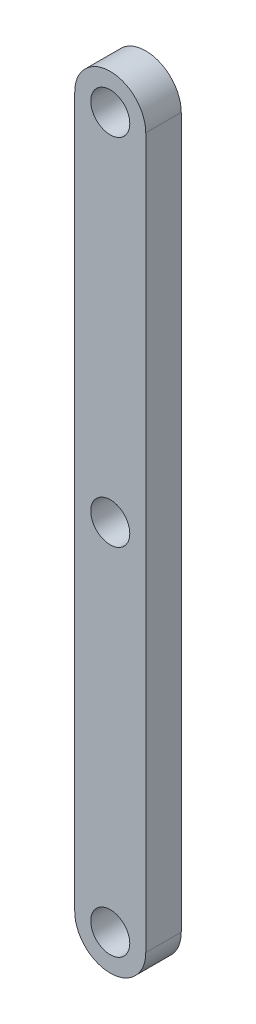
from build123d import *

# Parameters (mm, degrees)
CROQUIS1_R              = 1.1
SALIENTE_EXTRUIR1_DEPTH = 2


with BuildPart() as part:
    # Croquis1 → Saliente-Extruir1 (new body)
    with BuildSketch(Plane.XY):
        with BuildLine():
            Line((0, 0), (0, -40))
            ThreePointArc((0, -40), (2, -42), (4, -40))
            Line((4, -40), (4, 0))
            ThreePointArc((4, 0), (2, 2), (0, 0))
        make_face()
        with Locations((2, 0)):
            Circle(CROQUIS1_R, mode=Mode.SUBTRACT)
        with Locations((2, -40)):
            Circle(CROQUIS1_R, mode=Mode.SUBTRACT)
        with Locations((2, -20)):
            Circle(CROQUIS1_R, mode=Mode.SUBTRACT)
    extrude(amount=SALIENTE_EXTRUIR1_DEPTH)


solid = part.part
